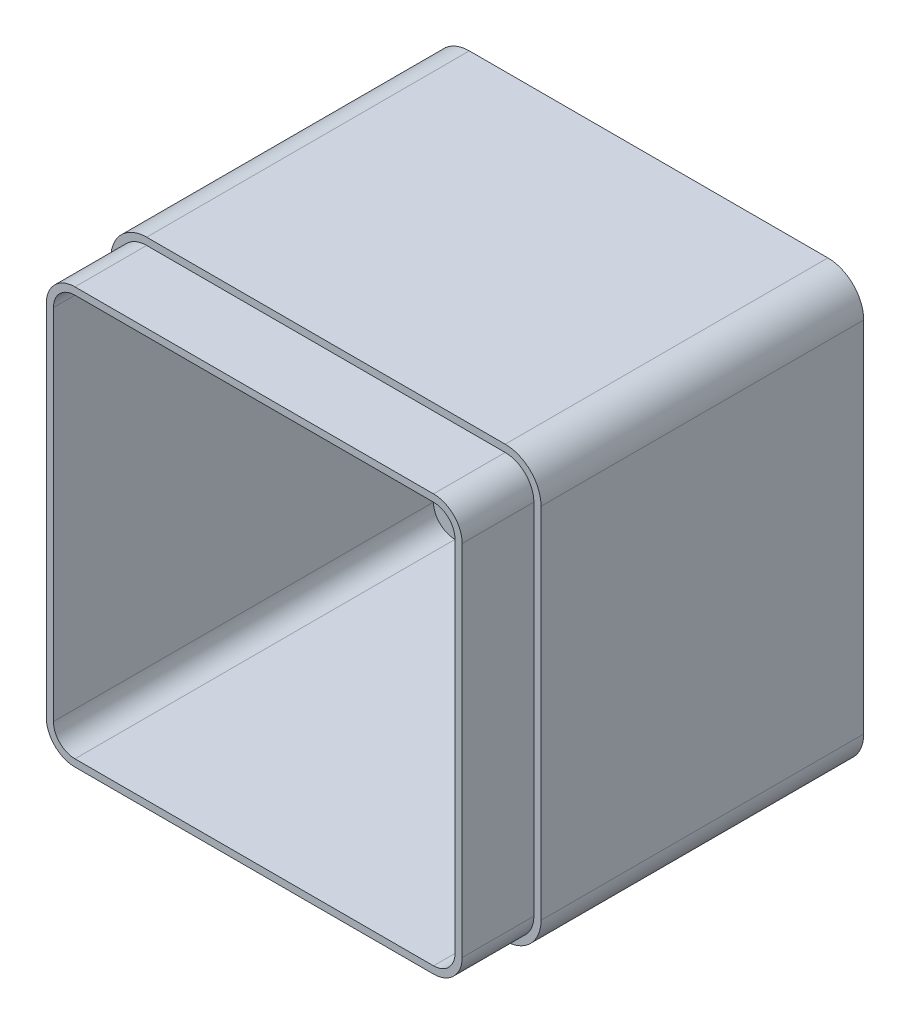
from build123d import *

# Parameters (mm, degrees)
SKETCH1_W           = 120
SKETCH1_H           = 120
BOSS_EXTRUDE1_DEPTH = 90
FILLET1_R           = 10
SHELL1_T            = -4
BOSS_EXTRUDE2_START = 20
BOSS_EXTRUDE2_DEPTH = 20


with BuildPart() as part:
    # Sketch1 → Boss-Extrude1 (new body)
    with BuildSketch(Plane.XY):
        with Locations((60, 60)):
            Rectangle(SKETCH1_W, SKETCH1_H)
    extrude(amount=BOSS_EXTRUDE1_DEPTH)

    # Fillet1
    fillet1_edges = [part.edges().sort_by_distance(p)[0] for p in [
        (0, 120, 45),
        (120, 120, 45),
        (120, 0, 45),
        (0, 0, 45),
    ]]
    fillet(fillet1_edges, radius=FILLET1_R)

    # Shell1
    shell1_openings = [part.faces().sort_by_distance(p)[0] for p in [
        (60, 60, 90),
    ]]
    offset(amount=SHELL1_T, openings=shell1_openings, kind=Kind.INTERSECTION)

    # Sketch3 → Boss-Extrude2 (add)
    with BuildSketch(Plane.XY.offset(90).offset(BOSS_EXTRUDE2_START)):
        with BuildLine():
            Line((110, 118), (10, 118))
            ThreePointArc((10, 118), (4.343145751, 115.656854249), (2, 110))
            Line((2, 110), (2, 10))
            ThreePointArc((2, 10), (4.343145751, 4.343145751), (10, 2))
            Line((10, 2), (110, 2))
            ThreePointArc((110, 2), (115.656854249, 4.343145751), (118, 10))
            Line((118, 10), (118, 110))
            ThreePointArc((118, 110), (115.656854249, 115.656854249), (110, 118))
        make_face()
        with BuildLine():
            ThreePointArc((10, 4), (5.757359313, 5.757359313), (4, 10))
            Line((4, 10), (4, 110))
            ThreePointArc((4, 110), (5.757359313, 114.242640687), (10, 116))
            Line((10, 116), (110, 116))
            ThreePointArc((110, 116), (114.242640687, 114.242640687), (116, 110))
            Line((116, 110), (116, 10))
            ThreePointArc((116, 10), (114.242640687, 5.757359313), (110, 4))
            Line((110, 4), (10, 4))
        make_face(mode=Mode.SUBTRACT)
    extrude(amount=-BOSS_EXTRUDE2_DEPTH)


solid = part.part
